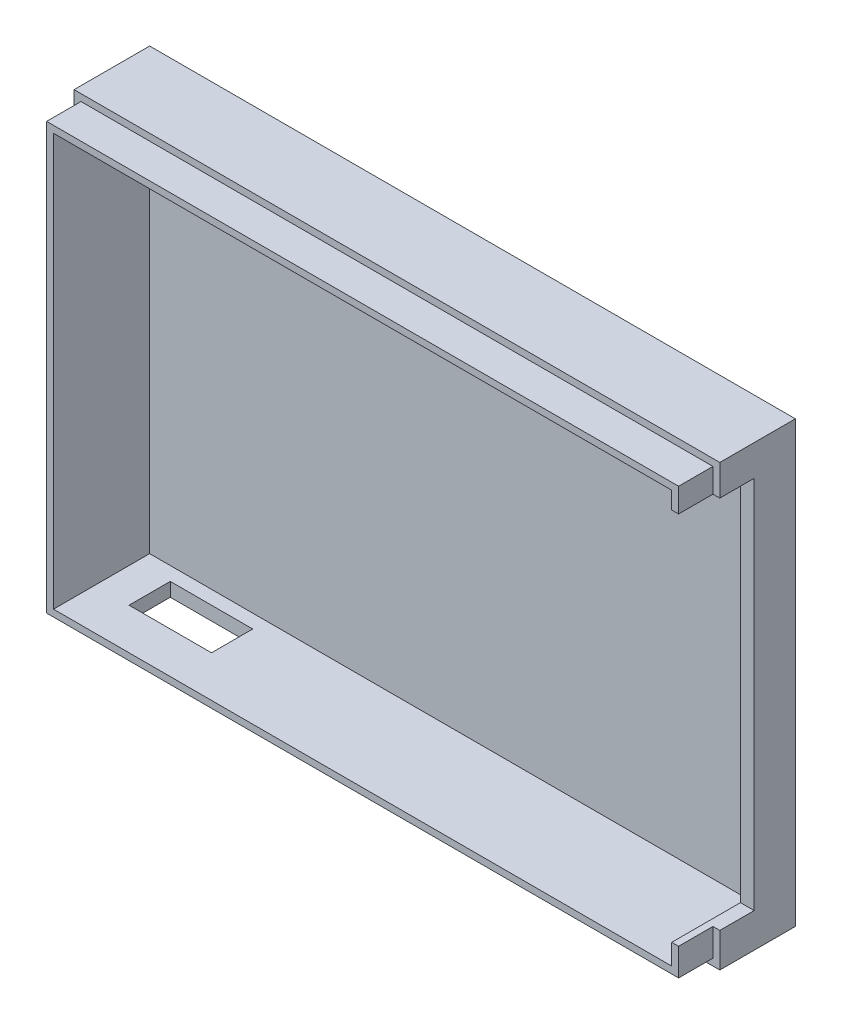
from build123d import *

# Parameters (mm, degrees)
SKETCH1_W           = 94
SKETCH1_H           = 64
BOSS_EXTRUDE1_DEPTH = 16
SKETCH2_W           = 90
SKETCH2_H           = 60
CUT_EXTRUDE1_DEPTH  = 14
SKETCH4_W           = 94
SKETCH4_H           = 64
SKETCH4_W_2         = 92
SKETCH4_H_2         = 62
CUT_EXTRUDE2_DEPTH  = 5
CUT_EXTRUDE3_REACH  = 83
SKETCH6_W           = 12
SKETCH6_H           = 6
CUT_EXTRUDE4_REACH  = 100.712
SKETCH8_W           = 10
SKETCH8_H           = 54.5


with BuildPart() as part:
    # Sketch1 → Boss-Extrude1 (new body)
    with BuildSketch(Plane.XY):
        Rectangle(SKETCH1_W, SKETCH1_H)
    extrude(amount=BOSS_EXTRUDE1_DEPTH)

    # Sketch2 → Cut-Extrude1 (cut)
    with BuildSketch(Plane.XY.offset(16)):
        Rectangle(SKETCH2_W, SKETCH2_H)
    extrude(amount=-CUT_EXTRUDE1_DEPTH, mode=Mode.SUBTRACT)

    # Sketch4 → Cut-Extrude2 (cut)
    with BuildSketch(Plane.XY.offset(16)):
        Rectangle(SKETCH4_W, SKETCH4_H)
        Rectangle(SKETCH4_W_2, SKETCH4_H_2, mode=Mode.SUBTRACT)
    extrude(amount=-CUT_EXTRUDE2_DEPTH, mode=Mode.SUBTRACT)

    # Sketch6 → Cut-Extrude3 (cut, up to next)
    with BuildSketch(Plane.XZ.offset(32), mode=Mode.PRIVATE) as cut_extrude3_sk1:
        with Locations((-34, 7)):
            Rectangle(SKETCH6_W, SKETCH6_H)
    cut_extrude3_tool1 = extrude(cut_extrude3_sk1.sketch, amount=-CUT_EXTRUDE3_REACH, mode=Mode.PRIVATE) & part.part
    add(cut_extrude3_tool1.solids().sort_by_distance((-34, -32, 7))[0], mode=Mode.SUBTRACT)

    # Sketch8 → Cut-Extrude4 (cut, up to next)
    with BuildSketch(Plane.ZY.offset(-45), mode=Mode.PRIVATE) as cut_extrude4_sk1:
        with Locations((11, 0.25)):
            Rectangle(SKETCH8_W, SKETCH8_H)
    cut_extrude4_tool1 = extrude(cut_extrude4_sk1.sketch, amount=-CUT_EXTRUDE4_REACH, mode=Mode.PRIVATE) & part.part
    add(cut_extrude4_tool1.solids().sort_by_distance((45, 0.25, 11))[0], mode=Mode.SUBTRACT)


solid = part.part
